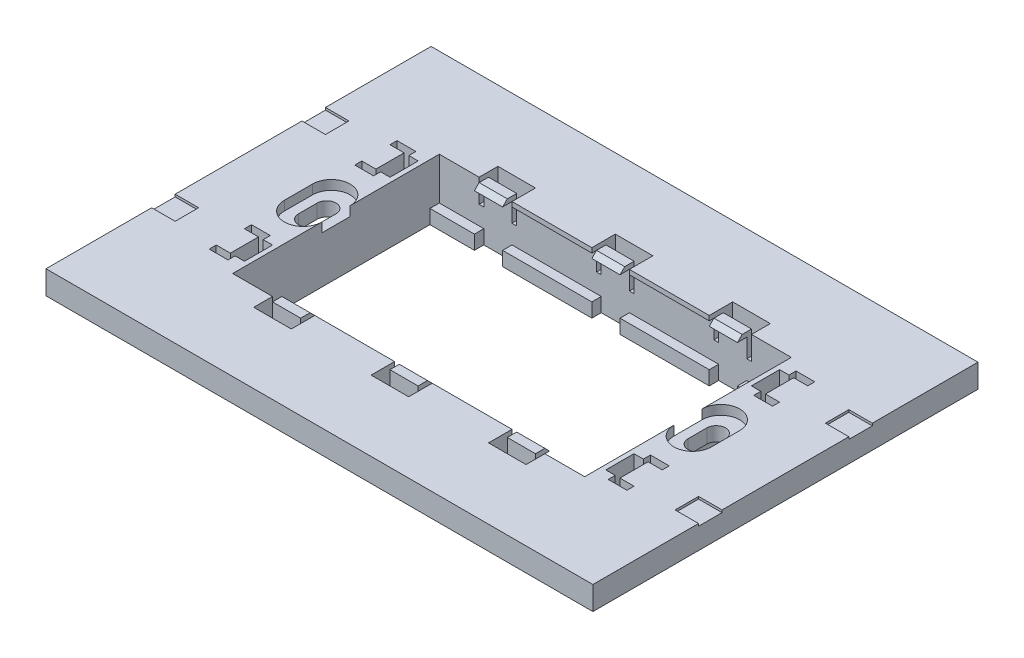
from build123d import *

# Parameters (mm, degrees)
CROQUIS1_W              = 116.45
CROQUIS1_H              = 82
SALIENTE_EXTRUIR2_DEPTH = 5
CROQUIS2_W              = 74.95
CROQUIS2_H              = 44
CORTAR_EXTRUIR1_DEPTH   = 5
CROQUIS3_W              = 76.95
CROQUIS3_H              = 46
CROQUIS3_W_2            = 74.95
CROQUIS3_H_2            = 44
SALIENTE_EXTRUIR3_DEPTH = 7
CROQUIS4_W              = 74.95
CROQUIS4_H              = 3
SALIENTE_EXTRUIR4_DEPTH = 3
CROQUIS5_W              = 3
CROQUIS5_H              = 2
CORTAR_EXTRUIR9_DEPTH   = 3
CROQUIS9_W              = 6
CROQUIS9_H              = 3
CORTAR_EXTRUIR10_DEPTH  = 1
CROQUIS10_W             = 74.95
CROQUIS10_H             = 3
CORTAR_EXTRUIR11_DEPTH  = 1
CROQUIS11_W             = 6
CROQUIS11_H             = 3
CORTAR_EXTRUIR12_DEPTH  = 1
CROQUIS12_W             = 74.95
CROQUIS12_H             = 3
CORTAR_EXTRUIR13_DEPTH  = 1
CROQUIS13_W             = 1
CROQUIS13_H             = 5
CORTAR_EXTRUIR21_DEPTH  = 4
CROQUIS14_W             = 1
CROQUIS14_H             = 5
CORTAR_EXTRUIR22_DEPTH  = 4
CROQUIS15_W             = 8
CROQUIS15_H             = 3
CORTAR_EXTRUIR23_DEPTH  = 16
SALIENTE_EXTRUIR8_DEPTH = 70
SALIENTE_EXTRUIR9_DEPTH = 70
CROQUIS18_W             = 19
CROQUIS18_H             = 42
CORTAR_EXTRUIR24_DEPTH  = 8
CROQUIS19_W             = 9.475
CROQUIS19_H             = 44
CORTAR_EXTRUIR26_DEPTH  = 8
CROQUIS20_W             = 1
CROQUIS20_H             = 44
CORTAR_EXTRUIR27_DEPTH  = 4
CROQUIS21_W             = 5
CROQUIS21_H             = 5
CORTAR_EXTRUIR28_DEPTH  = 0.5
CORTAR_EXTRUIR29_DEPTH  = 5
CORTAR_EXTRUIR30_DEPTH  = 2
CORTAR_EXTRUIR31_DEPTH  = 5


with BuildPart() as part:
    # Croquis1 → Saliente-Extruir2 (new body)
    with BuildSketch(Plane(origin=(0, 0, 0), x_dir=(1, 0, 0), z_dir=(0, 1, 0))):
        Rectangle(CROQUIS1_W, CROQUIS1_H)
    extrude(amount=SALIENTE_EXTRUIR2_DEPTH)

    # Croquis2 → Cortar-Extruir1 (cut)
    with BuildSketch(Plane(origin=(0, 5, 0), x_dir=(1, 0, 0), z_dir=(0, 1, 0))):
        Rectangle(CROQUIS2_W, CROQUIS2_H)
    extrude(amount=-CORTAR_EXTRUIR1_DEPTH, mode=Mode.SUBTRACT)

    # Croquis3 → Saliente-Extruir3 (add)
    with BuildSketch(Plane.XZ):
        Rectangle(CROQUIS3_W, CROQUIS3_H)
        Rectangle(CROQUIS3_W_2, CROQUIS3_H_2, mode=Mode.SUBTRACT)
    extrude(amount=SALIENTE_EXTRUIR3_DEPTH)

    # Croquis4 → Saliente-Extruir4 (add)
    with BuildSketch(Plane.XZ.offset(7)):
        with Locations((0, 20.5)):
            Rectangle(CROQUIS4_W, CROQUIS4_H)
        with Locations((0, -20.5)):
            Rectangle(CROQUIS4_W, CROQUIS4_H)
    extrude(amount=-SALIENTE_EXTRUIR4_DEPTH)

    # Croquis5 → Cortar-Extruir9 (cut)
    with BuildSketch(Plane.XZ.offset(7)):
        Polygon((25, -19), (22, -19), (22, -21), (28, -21), (28, -19), align=None)
        Polygon((22, 21), (22, 19), (25, 19), (28, 19), (28, 21), align=None)
        with Locations((1.5, 20)):
            Rectangle(CROQUIS5_W, CROQUIS5_H)
        with Locations((-1.5, 20)):
            Rectangle(CROQUIS5_W, CROQUIS5_H)
        with Locations((-1.5, -20)):
            Rectangle(CROQUIS5_W, CROQUIS5_H)
        with Locations((1.5, -20)):
            Rectangle(CROQUIS5_W, CROQUIS5_H)
        Polygon((-22, -21), (-22, -19), (-25, -19), (-28, -19), (-28, -21), align=None)
        Polygon((-25, 19), (-22, 19), (-22, 21), (-28, 21), (-28, 19), align=None)
    extrude(amount=-CORTAR_EXTRUIR9_DEPTH, mode=Mode.SUBTRACT)

    # Croquis9 → Cortar-Extruir10 (cut)
    with BuildSketch(Plane(origin=(0, 0, 21), x_dir=(-1, 0, 0), z_dir=(0, 0, -1))):
        with Locations((25, -5.5)):
            Rectangle(CROQUIS9_W, CROQUIS9_H)
        with Locations((0, -5.5)):
            Rectangle(CROQUIS9_W, CROQUIS9_H)
        with Locations((-25, -5.5)):
            Rectangle(CROQUIS9_W, CROQUIS9_H)
    extrude(amount=-CORTAR_EXTRUIR10_DEPTH, mode=Mode.SUBTRACT)

    # Croquis10 → Cortar-Extruir11 (cut)
    with BuildSketch(Plane(origin=(0, 0, 19), x_dir=(-1, 0, 0), z_dir=(0, 0, -1))):
        with Locations((0, -5.5)):
            Rectangle(CROQUIS10_W, CROQUIS10_H)
    extrude(amount=-CORTAR_EXTRUIR11_DEPTH, mode=Mode.SUBTRACT)

    # Croquis11 → Cortar-Extruir12 (cut)
    with BuildSketch(Plane.XY.offset(-21)):
        with Locations((25, -5.5)):
            Rectangle(CROQUIS11_W, CROQUIS11_H)
        with Locations((0, -5.5)):
            Rectangle(CROQUIS11_W, CROQUIS11_H)
        with Locations((-25, -5.5)):
            Rectangle(CROQUIS11_W, CROQUIS11_H)
    extrude(amount=-CORTAR_EXTRUIR12_DEPTH, mode=Mode.SUBTRACT)

    # Croquis12 → Cortar-Extruir13 (cut)
    with BuildSketch(Plane.XY.offset(-19)):
        with Locations((0, -5.5)):
            Rectangle(CROQUIS12_W, CROQUIS12_H)
    extrude(amount=-CORTAR_EXTRUIR13_DEPTH, mode=Mode.SUBTRACT)

    # Croquis13 → Cortar-Extruir21 (cut)
    with BuildSketch(Plane.XY.offset(-22)):
        with Locations((21.5, 2.5)):
            Rectangle(CROQUIS13_W, CROQUIS13_H)
        with Locations((3.5, 2.5)):
            Rectangle(CROQUIS13_W, CROQUIS13_H)
        with Locations((-3.5, 2.5)):
            Rectangle(CROQUIS13_W, CROQUIS13_H)
        with Locations((-28.5, 2.5)):
            Rectangle(CROQUIS13_W, CROQUIS13_H)
        with Locations((-21.5, 2.5)):
            Rectangle(CROQUIS13_W, CROQUIS13_H)
        with Locations((28.5, 2.5)):
            Rectangle(CROQUIS13_W, CROQUIS13_H)
    extrude(amount=-CORTAR_EXTRUIR21_DEPTH, mode=Mode.SUBTRACT)

    # Croquis14 → Cortar-Extruir22 (cut)
    with BuildSketch(Plane(origin=(0, 0, 22), x_dir=(-1, 0, 0), z_dir=(0, 0, -1))):
        with Locations((28.5, 2.5)):
            Rectangle(CROQUIS14_W, CROQUIS14_H)
        with Locations((-21.5, 2.5)):
            Rectangle(CROQUIS14_W, CROQUIS14_H)
        with Locations((21.5, 2.5)):
            Rectangle(CROQUIS14_W, CROQUIS14_H)
        with Locations((3.5, 2.5)):
            Rectangle(CROQUIS14_W, CROQUIS14_H)
        with Locations((-3.5, 2.5)):
            Rectangle(CROQUIS14_W, CROQUIS14_H)
        with Locations((-28.5, 2.5)):
            Rectangle(CROQUIS14_W, CROQUIS14_H)
    extrude(amount=-CORTAR_EXTRUIR22_DEPTH, mode=Mode.SUBTRACT)

    # Croquis15 → Cortar-Extruir23 (cut)
    with BuildSketch(Plane.XZ):
        with Locations((0, 24.5)):
            Rectangle(CROQUIS15_W, CROQUIS15_H)
        with Locations((-25, 24.5)):
            Rectangle(CROQUIS15_W, CROQUIS15_H)
        with Locations((25, 24.5)):
            Rectangle(CROQUIS15_W, CROQUIS15_H)
        with Locations((-25, -24.5)):
            Rectangle(CROQUIS15_W, CROQUIS15_H)
        with Locations((0, -24.5)):
            Rectangle(CROQUIS15_W, CROQUIS15_H)
        with Locations((25, -24.5)):
            Rectangle(CROQUIS15_W, CROQUIS15_H)
    extrude(amount=-CORTAR_EXTRUIR23_DEPTH, mode=Mode.SUBTRACT)

    # Croquis16 → Saliente-Extruir8 (add)
    with BuildSketch(Plane.ZY.offset(-37.475)):
        Polygon((-22, 5), (-21, 5), (-20, 4), (-22, 4), align=None)
    extrude(amount=SALIENTE_EXTRUIR8_DEPTH)

    # Croquis17 → Saliente-Extruir9 (add)
    with BuildSketch(Plane.ZY.offset(-37.475)):
        Polygon((22, 4), (22, 5), (21, 5), (20, 4), (21, 4), align=None)
    extrude(amount=SALIENTE_EXTRUIR9_DEPTH)

    # Croquis18 → Cortar-Extruir24 (cut)
    with BuildSketch(Plane(origin=(0, 5, 0), x_dir=(1, 0, 0), z_dir=(0, 1, 0))):
        with Locations((-12.5, 0)):
            Rectangle(CROQUIS18_W, CROQUIS18_H)
        with Locations((12.5, 0)):
            Rectangle(CROQUIS18_W, CROQUIS18_H)
    extrude(amount=-CORTAR_EXTRUIR24_DEPTH, mode=Mode.SUBTRACT)

    # Croquis19 → Cortar-Extruir26 (cut)
    with BuildSketch(Plane(origin=(0, 5, 0), x_dir=(1, 0, 0), z_dir=(0, 1, 0))):
        with Locations((32.7375, 0)):
            Rectangle(CROQUIS19_W, CROQUIS19_H)
        with Locations((-32.7375, 0)):
            Rectangle(CROQUIS19_W, CROQUIS19_H)
    extrude(amount=-CORTAR_EXTRUIR26_DEPTH, mode=Mode.SUBTRACT)

    # Croquis20 → Cortar-Extruir27 (cut)
    with BuildSketch(Plane(origin=(0, 5, 0), x_dir=(1, 0, 0), z_dir=(0, 1, 0))):
        with Locations((-3.5, 0)):
            Rectangle(CROQUIS20_W, CROQUIS20_H)
        with Locations((-21.5, 0)):
            Rectangle(CROQUIS20_W, CROQUIS20_H)
        with Locations((3.5, 0)):
            Rectangle(CROQUIS20_W, CROQUIS20_H)
        with Locations((21.5, 0)):
            Rectangle(CROQUIS20_W, CROQUIS20_H)
    extrude(amount=-CORTAR_EXTRUIR27_DEPTH, mode=Mode.SUBTRACT)

    # Croquis21 → Cortar-Extruir28 (cut)
    with BuildSketch(Plane(origin=(0, 5, 0), x_dir=(1, 0, 0), z_dir=(0, 1, 0))):
        Polygon((-53.225, -13.5), (-58.225, -13.5), (-58.225, -18.5), (-53.225, -18.5), (-53.225, -16), align=None)
        Polygon((-53.225, 18.5), (-58.225, 18.5), (-58.225, 13.5), (-53.225, 13.5), (-53.225, 16), align=None)
        Polygon((53.225, -18.5), (58.225, -18.5), (58.225, -13.5), (53.225, -13.5), (53.225, -16), align=None)
        with Locations((55.725, 16)):
            Rectangle(CROQUIS21_W, CROQUIS21_H)
    extrude(amount=-CORTAR_EXTRUIR28_DEPTH, mode=Mode.SUBTRACT)

    # Croquis22 → Cortar-Extruir29 (cut)
    with BuildSketch(Plane(origin=(0, 5, 0), x_dir=(1, 0, 0), z_dir=(0, 1, 0))):
        with BuildLine():
            Line((-39.475, -2), (-39.475, 2))
            ThreePointArc((-39.475, 2), (-41.475, 4), (-43.475, 2))
            Line((-43.475, 2), (-43.475, -2))
            ThreePointArc((-43.475, -2), (-41.475, -4), (-39.475, -2))
        make_face()
        with BuildLine():
            ThreePointArc((43.475, -2), (41.475, -4), (39.475, -2))
            Line((39.475, -2), (39.475, 2))
            ThreePointArc((39.475, 2), (41.475, 4), (43.475, 2))
            Line((43.475, 2), (43.475, -2))
        make_face()
    extrude(amount=-CORTAR_EXTRUIR29_DEPTH, mode=Mode.SUBTRACT)

    # Croquis23 → Cortar-Extruir30 (cut)
    with BuildSketch(Plane(origin=(0, 5, 0), x_dir=(1, 0, 0), z_dir=(0, 1, 0))):
        with BuildLine():
            Line((-37.475, 0), (-37.475, 3))
            ThreePointArc((-37.475, 3), (-41.475, 7), (-45.475, 3))
            Line((-45.475, 3), (-45.475, -3))
            ThreePointArc((-45.475, -3), (-41.475, -7), (-37.475, -3))
            Line((-37.475, -3), (-37.475, 0))
        make_face()
        with BuildLine():
            ThreePointArc((45.475, -3), (41.475, -7), (37.475, -3))
            Line((37.475, -3), (37.475, 0))
            Line((37.475, 0), (37.475, 3))
            ThreePointArc((37.475, 3), (41.475, 7), (45.475, 3))
            Line((45.475, 3), (45.475, -3))
        make_face()
    extrude(amount=-CORTAR_EXTRUIR30_DEPTH, mode=Mode.SUBTRACT)

    # Croquis24 → Cortar-Extruir31 (cut)
    with BuildSketch(Plane(origin=(0, 5, 0), x_dir=(1, 0, 0), z_dir=(0, 1, 0))):
        Polygon((-38.475, -12.5), (-38.475, -18.5), (-40.475, -18.5), (-40.475, -20), (-44.475, -20), (-44.475, -18.5), (-41.475, -18.5), (-41.475, -12.5), (-44.475, -12.5), (-44.475, -11), (-40.475, -11), (-40.475, -12.5), align=None)
        Polygon((-38.475, 12.5), (-40.475, 12.5), (-40.475, 11), (-44.475, 11), (-44.475, 12.5), (-41.475, 12.5), (-41.475, 18.5), (-44.475, 18.5), (-44.475, 20), (-40.475, 20), (-40.475, 18.5), (-38.475, 18.5), align=None)
        Polygon((38.475, 12.5), (38.475, 18.5), (40.475, 18.5), (40.475, 20), (44.475, 20), (44.475, 18.5), (41.475, 18.5), (41.475, 12.5), (44.475, 12.5), (44.475, 11), (40.475, 11), (40.475, 12.5), align=None)
        Polygon((38.475, -12.5), (40.475, -12.5), (40.475, -11), (44.475, -11), (44.475, -12.5), (41.475, -12.5), (41.475, -18.5), (44.475, -18.5), (44.475, -20), (40.475, -20), (40.475, -18.5), (38.475, -18.5), align=None)
    extrude(amount=-CORTAR_EXTRUIR31_DEPTH, mode=Mode.SUBTRACT)


solid = part.part
